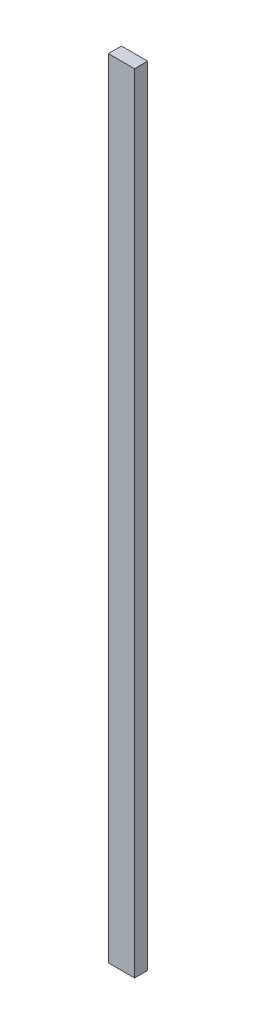
from build123d import *

# Parameters (mm, degrees)
ESQUISSE1_W        = 20
ESQUISSE1_H        = 600
BOSS_EXTRU_1_DEPTH = 10


with BuildPart() as part:
    # Esquisse1 → Boss.-Extru.1 (new body)
    with BuildSketch(Plane.XY):
        with Locations((10, 300)):
            Rectangle(ESQUISSE1_W, ESQUISSE1_H)
    extrude(amount=BOSS_EXTRU_1_DEPTH)


solid = part.part
